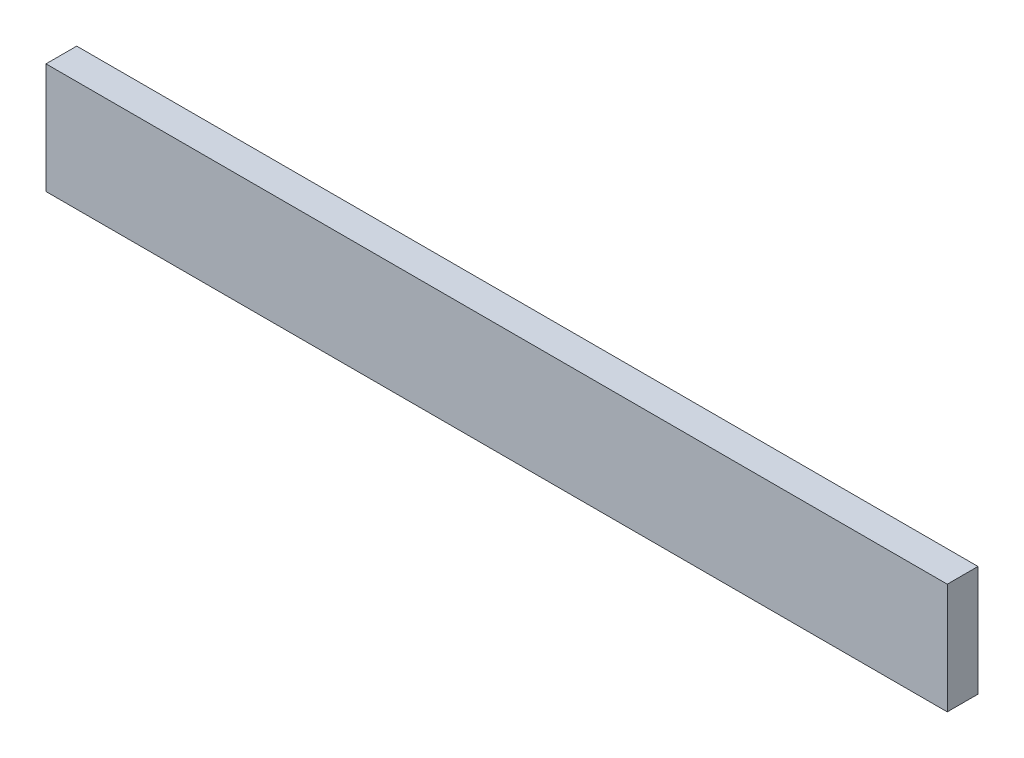
from build123d import *

# Parameters (mm, degrees)
ESQUISSE1_W        = 440
ESQUISSE1_H        = 54
BOSS_EXTRU_1_DEPTH = 15


with BuildPart() as part:
    # Esquisse1 → Boss.-Extru.1 (new body)
    with BuildSketch(Plane.XY):
        with Locations((220, 27)):
            Rectangle(ESQUISSE1_W, ESQUISSE1_H)
    extrude(amount=BOSS_EXTRU_1_DEPTH)


solid = part.part
